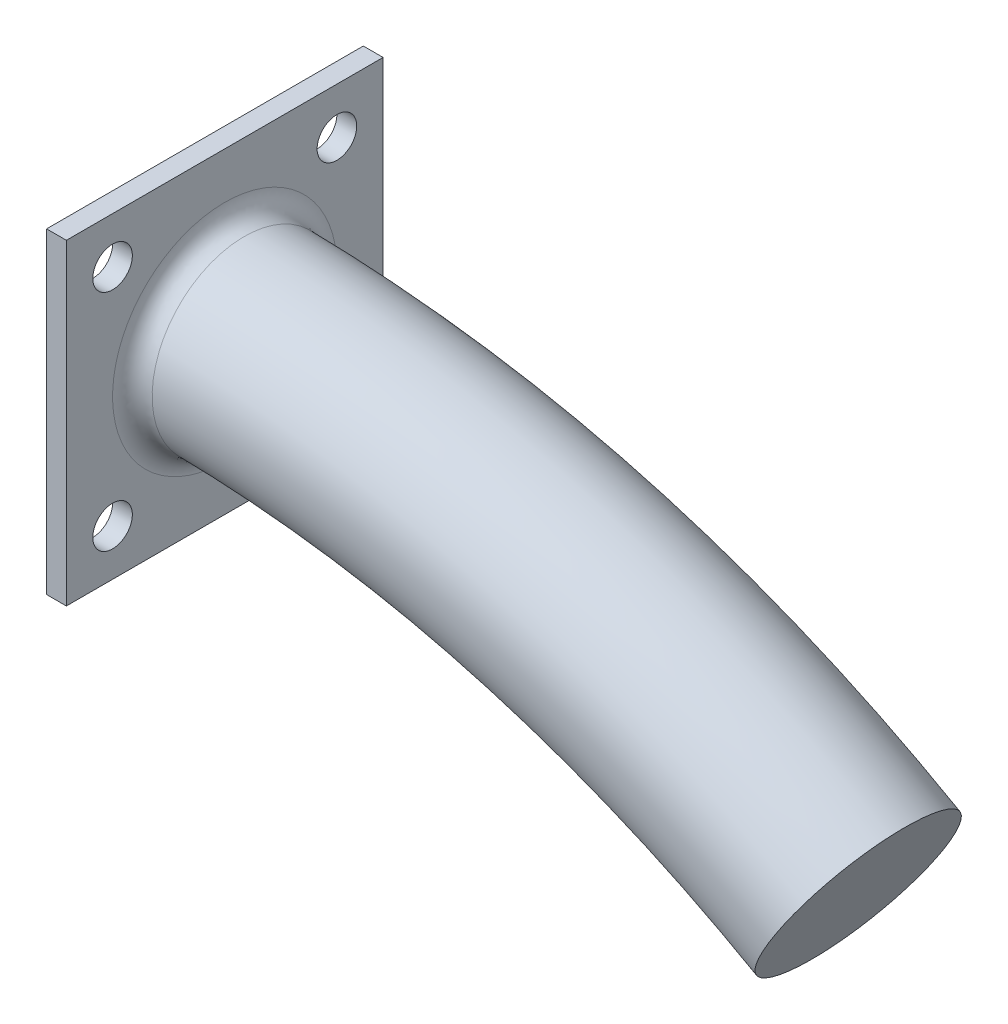
from build123d import *

# Parameters (mm, degrees)
SKETCH1_W      = 152.4
SKETCH1_H      = 152.4
SKETCH1_R      = 9.525
EXTRUDE1_DEPTH = 9.525
SKETCH3_R      = 44.45
FILLET1_R      = 9.525


with BuildPart() as part:
    # Sketch1 → Extrude1 (new body)
    with BuildSketch(Plane(origin=(0, 0, 0), x_dir=(0, 0, -1), z_dir=(1, 0, 0))):
        Rectangle(SKETCH1_W, SKETCH1_H)
        with Locations(Location((-53.975, 53.975, 0), (0, 0, 180))):
            Circle(SKETCH1_R, mode=Mode.SUBTRACT)
        with Locations(Location((-53.975, -53.975, 0), (0, 0, 180))):
            Circle(SKETCH1_R, mode=Mode.SUBTRACT)
        with Locations(Location((53.975, -53.975, 0), (0, 0, 180))):
            Circle(SKETCH1_R, mode=Mode.SUBTRACT)
        with Locations(Location((53.975, 53.975, 0), (0, 0, 180))):
            Circle(SKETCH1_R, mode=Mode.SUBTRACT)
    extrude(amount=EXTRUDE1_DEPTH)

    # Sweep1: sweep along a path in Sketch2
    with BuildLine(Plane.XY) as sweep1_path:
        ThreePointArc((9.525, 0), (167.301089894, -20.771616294), (314.325, -81.670913853))
    # Sketch3 → Sweep1 (sweep)
    with BuildSketch(Plane(origin=(9.525, 0, 0), x_dir=(0, 0, -1), z_dir=(1, 0, 0))):
        Circle(SKETCH3_R)
    sweep(path=sweep1_path.line)

    # Fillet1
    fillet1_edges = [part.edges().sort_by_distance(p)[0] for p in [
        (9.525, 0, 44.45),
    ]]
    fillet(fillet1_edges, radius=FILLET1_R)


solid = part.part
